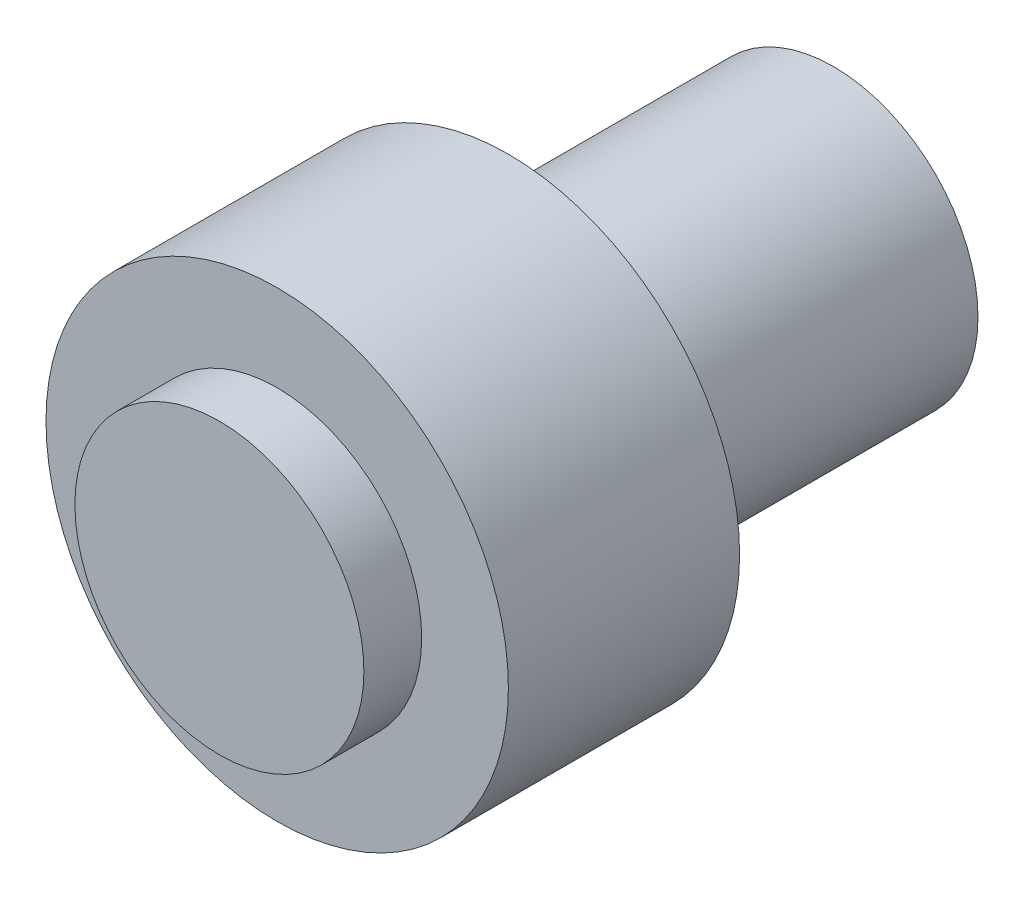
from build123d import *

# Parameters (mm, degrees)
CUT_EXTRUDE1_START = -2.54
SKETCH2_R          = 10.195320638
SKETCH2_R_2        = 6.35
CUT_EXTRUDE1_DEPTH = 2.54


with BuildPart() as part:
    # Sketch1 → Revolve1 (revolve)
    with BuildSketch(Plane(origin=(0, 0, 0), x_dir=(0, 0, -1), z_dir=(1, 0, 0)), mode=Mode.PRIVATE) as revolve1_sk:
        Polygon((0, 0), (0, 10.16), (12.7, 10.16), (12.7, 6.35), (26.9875, 6.35), (26.9875, 0), align=None)
    revolve(revolve1_sk.sketch.rotate(Axis((0, 0, 0), (0, 0, -1)), 90), axis=Axis((0, 0, 0), (0, 0, -1)))

    # Sketch2 → Cut-Extrude1 (cut)
    with BuildSketch(Plane.XY.offset(CUT_EXTRUDE1_START)):
        Circle(SKETCH2_R)
        Circle(SKETCH2_R_2, mode=Mode.SUBTRACT)
    extrude(amount=CUT_EXTRUDE1_DEPTH, mode=Mode.SUBTRACT)


solid = part.part
